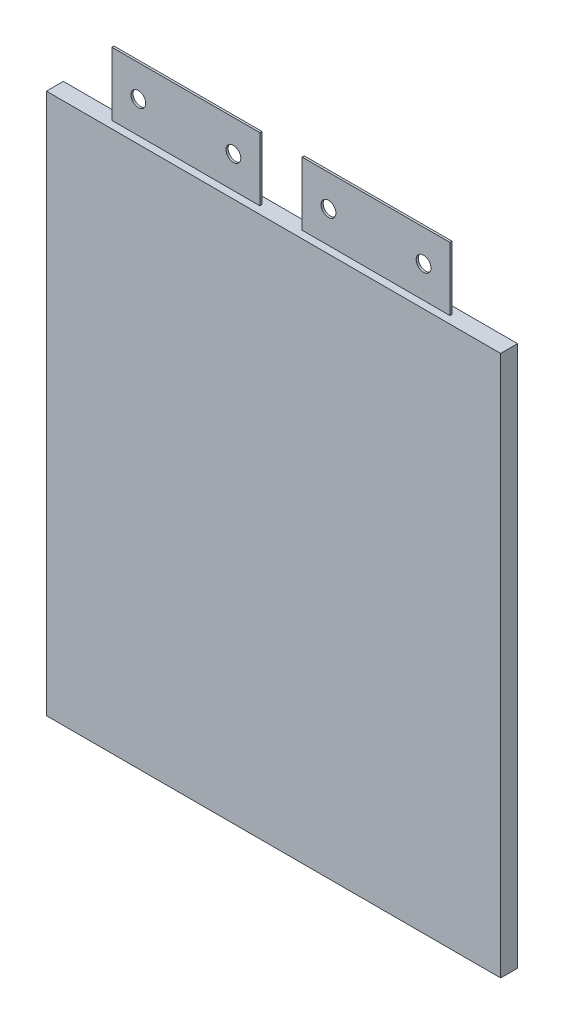
from build123d import *

# Parameters (mm, degrees)
SKETCH2_W           = 215
SKETCH2_H           = 256
BOSS_EXTRUDE1_DEPTH = 8
SKETCH3_W           = 70
SKETCH3_H           = 1
BOSS_EXTRUDE3_DEPTH = 30
CUT_EXTRUDE1_REACH  = 359.829
SKETCH5_R           = 3.5


with BuildPart() as part:
    # Sketch2 → Boss-Extrude1 (new body)
    with BuildSketch(Plane.XY):
        with Locations((107.5, 128)):
            Rectangle(SKETCH2_W, SKETCH2_H)
    extrude(amount=BOSS_EXTRUDE1_DEPTH)

    # Sketch3 → Boss-Extrude3 (add)
    with BuildSketch(Plane(origin=(0, 256, 0), x_dir=(1, 0, 0), z_dir=(0, 1, 0))):
        with Locations((62.5, -4)):
            Rectangle(SKETCH3_W, SKETCH3_H)
        with Locations((152.5, -4)):
            Rectangle(SKETCH3_W, SKETCH3_H)
    extrude(amount=BOSS_EXTRUDE3_DEPTH)

    # Sketch5 → Cut-Extrude1 (cut, up to next)
    with BuildSketch(Plane.XY.offset(4.5), mode=Mode.PRIVATE) as cut_extrude1_sk1:
        with Locations((40, 271)):
            Circle(SKETCH5_R)
    cut_extrude1_tool1 = extrude(cut_extrude1_sk1.sketch, amount=-CUT_EXTRUDE1_REACH, mode=Mode.PRIVATE) & part.part
    # Sketch5 → Cut-Extrude1 (cut, up to next)
    with BuildSketch(Plane.XY.offset(4.5), mode=Mode.PRIVATE) as cut_extrude1_sk2:
        with Locations((85, 271)):
            Circle(SKETCH5_R)
    cut_extrude1_tool2 = extrude(cut_extrude1_sk2.sketch, amount=-CUT_EXTRUDE1_REACH, mode=Mode.PRIVATE) & part.part
    cut_extrude1_1 = cut_extrude1_tool1.solids().sort_by_distance((40, 271, 4.5))[0]
    add(cut_extrude1_1, mode=Mode.SUBTRACT)
    cut_extrude1_2 = cut_extrude1_tool2.solids().sort_by_distance((85, 271, 4.5))[0]
    add(cut_extrude1_2, mode=Mode.SUBTRACT)
    cut_extrude1 = cut_extrude1_1 + cut_extrude1_2  # Cut-Extrude1 as one shape, for the pattern or mirror that repeats it

    # Mirror1: Cut-Extrude1 across plane
    add(cut_extrude1.mirror(Plane(origin=(107.5, 0, 0), x_dir=(0, 0, 1), z_dir=(1, 0, 0))), mode=Mode.SUBTRACT)


solid = part.part
